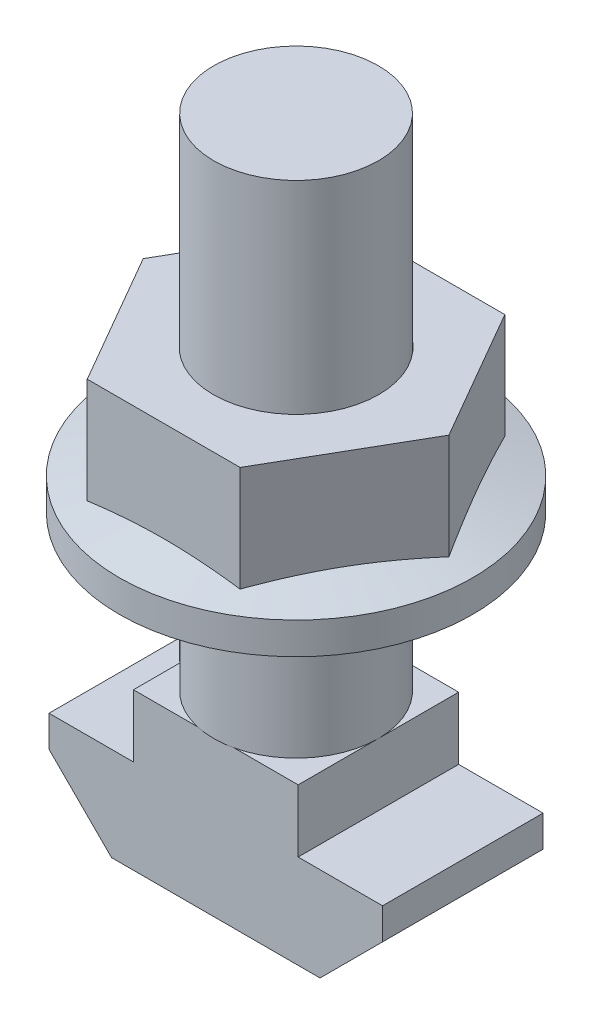
from build123d import *

# Parameters (mm, degrees)
SKETCH1_R           = 3.95
BOSS_EXTRUDE1_DEPTH = 24
BOSS_EXTRUDE2_DEPTH = 3.85
BOSS_EXTRUDE3_START = 7.41
SKETCH8_R           = 3.96875
BOSS_EXTRUDE3_DEPTH = 6.8834


with BuildPart() as part:
    # Sketch1 → Boss-Extrude1 (new body)
    with BuildSketch(Plane(origin=(0, 0, 0), x_dir=(1, 0, 0), z_dir=(0, 1, 0))):
        with Locations(Location((0, 0, 0), (0, 0, 270))):
            Circle(SKETCH1_R)
    extrude(amount=BOSS_EXTRUDE1_DEPTH)

    # Sketch5 → Boss-Extrude2 (add, symmetric)
    with BuildSketch(Plane.XY):
        Polygon((-3.949999974, 0), (3.949999974, 0), (3.949999974, -3), (8, -3), (8, -4.5), (5, -7.5), (-5, -7.5), (-8, -4.5), (-8, -3), (-3.949999974, -3), align=None)
    extrude(amount=BOSS_EXTRUDE2_DEPTH, both=True)


with BuildPart() as body_2:
    # Sketch8 → Boss-Extrude3 (new body)
    with BuildSketch(Plane(origin=(0, 0, 0), x_dir=(1, 0, 0), z_dir=(0, 1, 0)).offset(BOSS_EXTRUDE3_START)):
        Polygon((7.332348419, 0), (3.666174209, 6.35), (-3.666174209, 6.35), (-7.332348419, 0), (-3.666174209, -6.35), (3.666174209, -6.35), align=None)
        with Locations(Location((0, 0, 0), (0, 0, 270))):
            Circle(SKETCH8_R, mode=Mode.SUBTRACT)
    extrude(amount=BOSS_EXTRUDE3_DEPTH)

    # Sketch10 → Revolve1 (revolve)
    with BuildSketch(Plane.XY, mode=Mode.PRIVATE) as revolve1_sk:
        Polygon((-3.666174209, 7.41), (-8.4709, 7.41), (-8.4709, 8.934), (-3.666174209, 10.221422395), align=None)
    revolve(revolve1_sk.sketch.rotate(Axis((0, 24, 0), (0, -1, 0)), 60.00000001), axis=Axis((0, 24, 0), (0, -1, 0)))


solid = Compound([part.part, body_2.part])
